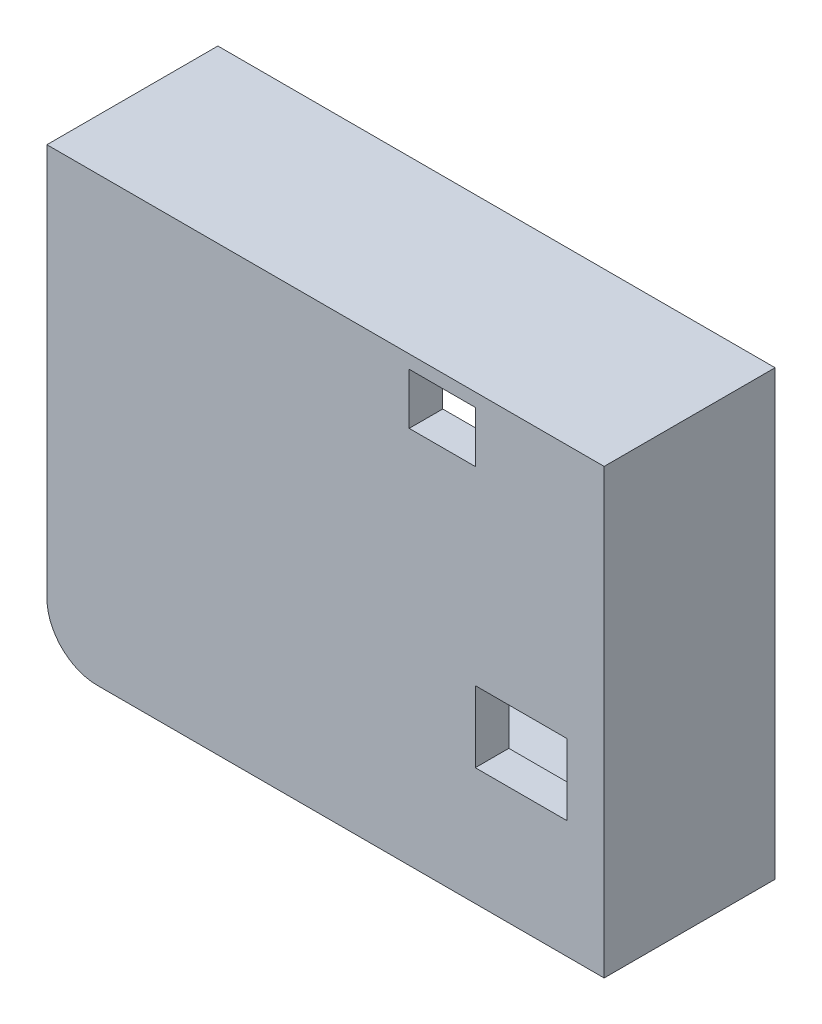
from build123d import *

# Parameters (mm, degrees)
PERIMETER_START     = -6.19
PERIMETER_DEPTH     = 8.19
FILLET1_R           = 3
BOSS_EXTRUDE3_START = 2
SKETCH2_8_W         = 5.473282091
SKETCH2_8_H         = 4.239040608
BOSS_EXTRUDE3_DEPTH = 2
FILLET3_R           = 3


with BuildPart() as part:
    # Sketch2 → Perimeter (new body)
    with BuildSketch(Plane.XY.offset(PERIMETER_START)):
        Polygon((131.091872, -113.860488221), (131.091872, -125.165005986), (164.307694987, -125.165005986), (164.307694987, -114.861877626), (164.307694987, -107.096275934), (164.307694987, -98.754254601), (131.091872, -98.754254601), (131.091872, -106.09488653), align=None)
        Polygon((133.091872, -99.55), (152.68714679, -99.55), (156.626717909, -99.55), (162.307694987, -99.55), (162.307694987, -123.165005986), (133.091872, -123.165005986), align=None, mode=Mode.SUBTRACT)
    extrude(amount=PERIMETER_DEPTH)

    # Fillet1
    fillet1_edges = [part.edges().sort_by_distance(p)[0] for p in [
        (133.091872, -123.165005986, -2.095),
        (131.091872, -125.165005986, -2.095),
    ]]
    fillet(fillet1_edges, radius=FILLET1_R)

    # Sketch2<8> → Boss-Extrude3 (add)
    # profile 1 of 2: a face of its own
    with BuildSketch(Plane.XY.offset(BOSS_EXTRUDE3_START)):
        Polygon((131.091872, -113.860488221), (131.091872, -125.165005986), (164.307694987, -125.165005986), (164.307694987, -114.861877626), (164.307694987, -107.096275934), (164.307694987, -98.754254601), (131.091872, -98.754254601), (131.091872, -106.09488653), align=None)
        Polygon((133.091872, -99.55), (152.68714679, -99.55), (156.626717909, -99.55), (162.307694987, -99.55), (162.307694987, -123.165005986), (133.091872, -123.165005986), align=None, mode=Mode.SUBTRACT)
    # profile 2 of 2: a face of its own
    with BuildSketch(Plane.XY.offset(BOSS_EXTRUDE3_START)):
        Polygon((156.626717909, -102.601169367), (152.68714679, -102.601169367), (152.68714679, -99.55), (133.091872, -99.55), (133.091872, -123.165005986), (162.307694987, -123.165005986), (162.307694987, -99.55), (156.626717909, -99.55), align=None)
        with Locations((159.363358955, -116.030479696)):
            Rectangle(SKETCH2_8_W, SKETCH2_8_H, mode=Mode.SUBTRACT)
    extrude(amount=BOSS_EXTRUDE3_DEPTH)

    # Fillet3
    fillet3_edges = [part.edges().sort_by_distance(p)[0] for p in [
        (131.091872, -125.165005986, 3),
    ]]
    fillet(fillet3_edges, radius=FILLET3_R)


solid = part.part
